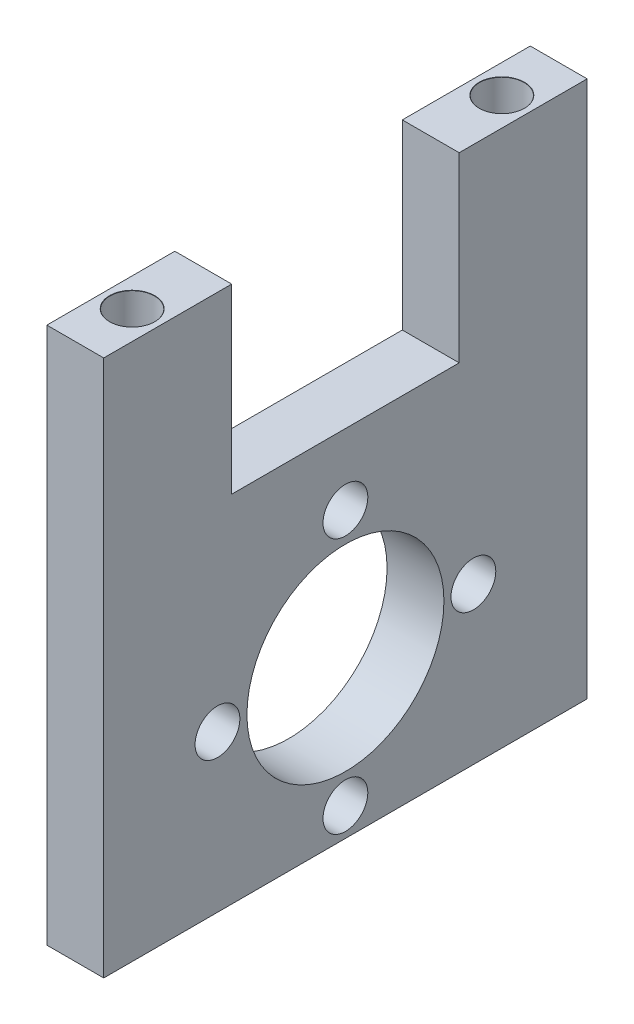
from build123d import *

# Parameters (mm, degrees)
BOSS_EXTRUDE1_START             = 199.569918
SKETCH6_R                       = 10.9982
BOSS_EXTRUDE1_DEPTH             = 6.35
F_5_0MM_DOWEL_HOLE2_D           = 5
F_5_0MM_DOWEL_HOLE2_DEPTH       = 25.4
F_5_0MM_DOWEL_HOLE2_CSINK_D     = 5.05
F_5_0MM_DOWEL_HOLE2_CSINK_ANGLE = 90
F_5_0MM_DOWEL_HOLE2_TIP         = 1.502151548
F_5_0MM_DOWEL_HOLE3_D           = 5
F_5_0MM_DOWEL_HOLE3_DEPTH       = 25.4
F_5_0MM_DOWEL_HOLE3_CSINK_D     = 5.05
F_5_0MM_DOWEL_HOLE3_CSINK_ANGLE = 90
F_5_0MM_DOWEL_HOLE3_TIP         = 1.502151548


with BuildPart() as part:
    # Sketch6 → Boss-Extrude1 (new body)
    with BuildSketch(Plane(origin=(0, 0, 0), x_dir=(0, 0, -1), z_dir=(1, 0, 0)).offset(BOSS_EXTRUDE1_START)):
        Polygon((74.6125, 36.5633), (128.5875, 36.5633), (128.5875, 96.52), (114.3, 96.52), (114.3, 76.2), (88.9, 76.2), (88.9, 96.52), (74.6125, 96.52), align=None)
        with Locations((101.6, 54.0258)):
            Circle(SKETCH6_R, mode=Mode.SUBTRACT)
    extrude(amount=-BOSS_EXTRUDE1_DEPTH)

    # Ø5.0mm Dowel Hole2
    with Locations(Plane.ZY.offset(-193.219917581)):
        with Locations((-101.6, 68.3133), (-87.3125, 54.0258), (-101.6, 39.7383), (-115.8875, 54.0258)):
            CounterSinkHole(F_5_0MM_DOWEL_HOLE2_D / 2, F_5_0MM_DOWEL_HOLE2_CSINK_D / 2, depth=F_5_0MM_DOWEL_HOLE2_DEPTH, counter_sink_angle=F_5_0MM_DOWEL_HOLE2_CSINK_ANGLE)
            with Locations((0, 0, -(F_5_0MM_DOWEL_HOLE2_DEPTH + F_5_0MM_DOWEL_HOLE2_TIP / 2))):  # 118° drill point
                Cone(0, F_5_0MM_DOWEL_HOLE2_D / 2, F_5_0MM_DOWEL_HOLE2_TIP, mode=Mode.SUBTRACT)

    # Ø5.0mm Dowel Hole3
    with Locations(Plane(origin=(0, 96.52, 0), x_dir=(1, 0, 0), z_dir=(0, 1, 0))):
        with Locations((196.394917581, 80.9625), (196.394917581, 122.2375)):
            CounterSinkHole(F_5_0MM_DOWEL_HOLE3_D / 2, F_5_0MM_DOWEL_HOLE3_CSINK_D / 2, depth=F_5_0MM_DOWEL_HOLE3_DEPTH, counter_sink_angle=F_5_0MM_DOWEL_HOLE3_CSINK_ANGLE)
            with Locations((0, 0, -(F_5_0MM_DOWEL_HOLE3_DEPTH + F_5_0MM_DOWEL_HOLE3_TIP / 2))):  # 118° drill point
                Cone(0, F_5_0MM_DOWEL_HOLE3_D / 2, F_5_0MM_DOWEL_HOLE3_TIP, mode=Mode.SUBTRACT)


solid = part.part
